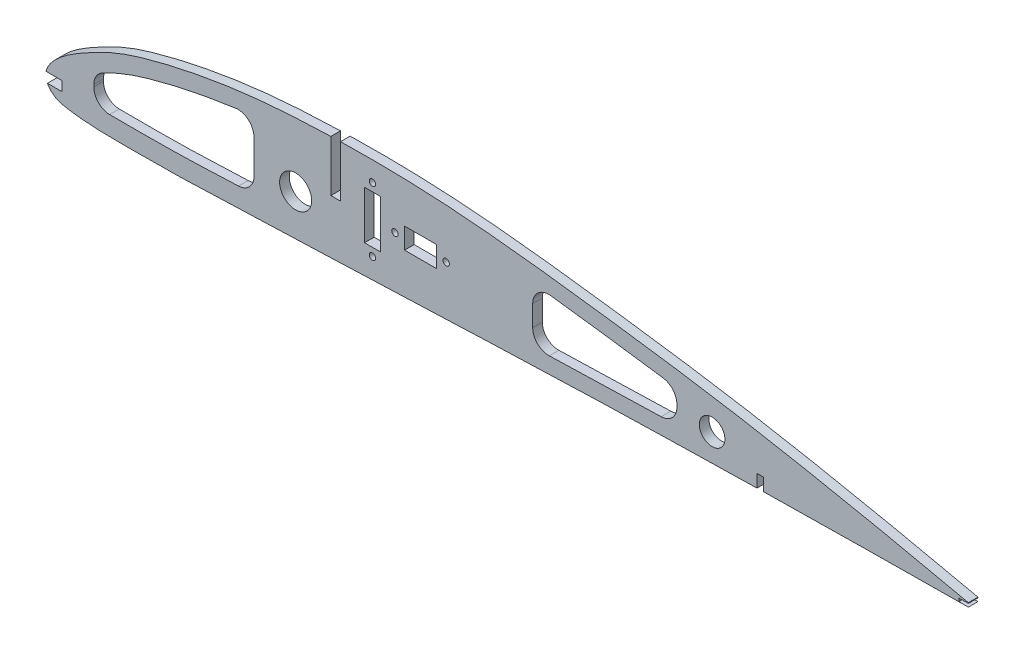
from build123d import *

# Parameters (mm, degrees)
SKETCH_1_R          = 5
SKETCH_1_R_2        = 4
EXTRUDE_1_DEPTH     = 3
SKETCH_3_R          = 1
SKETCH_3_W          = 10
SKETCH_3_H          = 6.5
SKETCH_3_W_2        = 5
SKETCH_3_H_2        = 15
CUT_EXTRUDE_2_DEPTH = 291.422386836


with BuildPart() as part:
    # 草图1 → 凸台-拉伸1 (new body)
    with BuildSketch(Plane.XY):
        with BuildLine():
            Line((90, 12.3715), (90, 28.372426217))
            add(Edge.make_bspline(
                [(90, 28.372426217), (89.259446982, 28.350928743), (82.363996343, 28.13322439), (72.403347361, 27.586524792), (60.185862052, 26.226268085), (51.080991088, 24.79810862), (42.033943524, 23.000087944), (34.581994337, 21.174922903), (28.697351661, 19.44563851), (24.361981086, 17.983441115), (20.174828998, 16.207949367), (16.078941989, 14.139912989), (12.040296713, 11.946766626), (8.14011433, 9.56039573), (5.153679337, 7.316395724), (3.100060439, 5.200618052), (1.813825976, 3.470730924), (1.237398467, 2.180506339), (1.085380705, 1.529058937), (1.078882286, 1.5)],
                knots=[0.345773533, 0.345773533, 0.345773533, 0.345773533, 0.349398211, 0.379527288, 0.394591827, 0.409656366, 0.424720905, 0.439785444, 0.447317713, 0.454849983, 0.462382252, 0.469914522, 0.477446791, 0.484979061, 0.49251133, 0.496277465, 0.5000436, 0.503809734, 0.503985678, 0.503985678, 0.503985678, 0.503985678], degree=3))
            Line((1.078882286, 1.5), (6, 1.5))
            Line((6, 1.5), (6, -1.5))
            Line((6, -1.5), (1.522379628, -1.5))
            add(Edge.make_bspline(
                [(1.522379628, -1.5), (1.617903461, -1.678770523), (2.068186491, -2.42442122), (3.143139608, -3.601090845), (4.854253, -4.619355756), (6.927567017, -5.105597911), (9.209034621, -5.454839075), (12.219971865, -5.84289763), (16.020132359, -6.14266222), (20.609524976, -6.2611368), (25.231457517, -6.286948592), (31.397380169, -6.280305851), (39.107274969, -6.240736398), (48.336813051, -6.022096429), (57.579935967, -5.612990736), (66.840654471, -5.242934226), (76.096556555, -4.921715721), (88.435998513, -4.515955408), (103.853120896, -3.973102953), (122.354625015, -3.248110744), (140.857835973, -2.495489966), (159.368527813, -1.804089638), (177.884173919, -1.222493213), (196.4033921, -0.774877257), (211.439290174, -0.454334834), (220.305576898, -0.265987383), (223, -0.210849605)],
                knots=[0.510182255, 0.510182255, 0.510182255, 0.510182255, 0.511342004, 0.515108139, 0.518874273, 0.522640408, 0.526406543, 0.530172677, 0.537704947, 0.545237216, 0.552769486, 0.560301755, 0.575366294, 0.590430833, 0.605495372, 0.620559911, 0.63562445, 0.650688989, 0.680818067, 0.710947144, 0.741076222, 0.7712053, 0.801334378, 0.831463456, 0.861592533, 0.874744372, 0.874744372, 0.874744372, 0.874744372], degree=3))
            Line((223, -0.210849605), (223, 3.788737263))
            Line((223, 3.788737263), (225, 3.788737263))
            Line((225, 3.788737263), (225, -0.170338801))
            add(Edge.make_bspline(
                [(225, -0.170338801), (227.811595191, -0.114017747), (236.796798206, 0.056910764), (251.961175933, 0.256656825), (270.471854229, 0.429163033), (282.824771355, 0.587434741), (289, 0.610062865)],
                knots=[0.877998396, 0.877998396, 0.877998396, 0.877998396, 0.891721611, 0.921850689, 0.951979767, 0.982108845, 0.982108845, 0.982108845, 0.982108845], degree=3))
            Line((289, 0.610062865), (286, 0.610062865))
            Line((286, 0.610062865), (286, 1.610062865))
            Line((286, 1.610062865), (289, 1.610062865))
            Line((289, 1.610062865), (289, 1.816246039))
            add(Edge.make_bspline(
                [(289, 1.816246039), (276.957314444, 4.502285023), (258.861554155, 8.397620333), (234.648247971, 13.152786595), (216.448478593, 16.478914183), (198.182873559, 19.371550405), (179.850571346, 21.924148488), (161.503162682, 24.358614825), (143.127892269, 26.473190985), (124.712239059, 28.043780086), (107.994173705, 28.616385423), (97.416270032, 28.546670082), (93, 28.44913561)],
                knots=[0.017978355, 0.017978355, 0.017978355, 0.017978355, 0.07823651, 0.108365588, 0.138494666, 0.168623744, 0.198752821, 0.228881899, 0.259010977, 0.289140055, 0.319269133, 0.340879606, 0.340879606, 0.340879606, 0.340879606], degree=3))
            Line((93, 28.44913561), (93, 12.3715))
            Line((93, 12.3715), (90, 12.3715))
        make_face()
        with Locations((79, 8)):
            Circle(SKETCH_1_R, mode=Mode.SUBTRACT)
        with Locations((209, 8)):
            Circle(SKETCH_1_R_2, mode=Mode.SUBTRACT)
    extrude(amount=EXTRUDE_1_DEPTH)

    # 草图3 → 切除-拉伸2 (cut, through all)
    with BuildSketch(Plane.XY):
        with Locations(Location((110, 12.3715, 0), (0, 0, 180))):
            Circle(SKETCH_3_R)
        with Locations(Location((126, 12.3715, 0), (0, 0, 180))):
            Circle(SKETCH_3_R)
        with Locations(Location((103, 22.3715, 0), (0, 0, 180))):
            Circle(SKETCH_3_R)
        with Locations(Location((103, 2.3715, 0), (0, 0, 180))):
            Circle(SKETCH_3_R)
        with BuildLine():
            Line((16, 5.402967421), (16, 4.74959002))
            ThreePointArc((16, 4.74959002), (17.438137187, 1.240582567), (20.925253321, -0.249851242))
            add(Edge.make_bspline(
                [(20.925253321, -0.249851242), (22.914045789, -0.279585692), (24.903284625, -0.283778057), (29.14616948, -0.28369414), (31.399982567, -0.278002295), (38.161511328, -0.238823637), (42.669255398, -0.168803371), (51.680216376, 0.117967683), (56.183014764, 0.33147635), (60.85831542, 0.520784363), (61.02954636, 0.527691534), (61.200778311, 0.534573017)],
                knots=[0.014317915, 0.014317915, 0.014317915, 0.014317915, 0.020284927, 0.020284927, 0.027046569, 0.027046569, 0.040569854, 0.040569854, 0.054093138, 0.054093138, 0.054607249, 0.054607249, 0.054607249, 0.054607249], degree=3))
            ThreePointArc((61.200778311, 0.534573017), (64.605821096, 2.066719442), (66, 5.530540197))
            Line((66, 5.530540197), (66, 16.175207171))
            ThreePointArc((66, 16.175207171), (64.287676463, 19.942325894), (60.32352661, 21.129234195))
            add(Edge.make_bspline(
                [(60.32352661, 21.129234195), (59.143282742, 20.968071656), (57.964431768, 20.796736398), (53.109249428, 20.046773379), (49.445857595, 19.384253181), (42.158673028, 17.868714577), (38.533379611, 17.019586343), (33.148990447, 15.546220745), (31.362942012, 15.022439399), (27.821005995, 13.880218625), (26.067238608, 13.253271835), (22.635818059, 11.812670552), (20.957942753, 11.004847704), (19.099592195, 10.049689097), (18.896441621, 9.944700093), (18.693547477, 9.839213217)],
                knots=[0.029920383, 0.029920383, 0.029920383, 0.029920383, 0.033494004, 0.033494004, 0.044658672, 0.044658672, 0.05582334, 0.05582334, 0.061405674, 0.061405674, 0.066988008, 0.066988008, 0.072570342, 0.072570342, 0.073256353, 0.073256353, 0.073256353, 0.073256353], degree=3))
            ThreePointArc((18.693547477, 9.839213217), (16.726110517, 7.997937304), (16, 5.402967421))
        make_face()
        with Locations((118, 12.3715)):
            Rectangle(SKETCH_3_W, SKETCH_3_H)
        with Locations((103, 12.3715)):
            Rectangle(SKETCH_3_W_2, SKETCH_3_H_2)
        with BuildLine():
            Line((153, 14.659796962), (153, 8.136010376))
            ThreePointArc((153, 8.136010376), (154.52636013, 4.539647484), (158.17353042, 3.139022564))
            add(Edge.make_bspline(
                [(158.17353042, 3.139022564), (161.058246521, 3.239200114), (163.943505856, 3.335590583), (171.504636491, 3.576232826), (176.18199895, 3.713351663), (184.945921303, 3.946800138), (189.03214497, 4.046860263), (193.116453453, 4.14201244)],
                knots=[0.711426146, 0.711426146, 0.711426146, 0.711426146, 0.75, 0.75, 0.8125, 0.8125, 0.867133534, 0.867133534, 0.867133534, 0.867133534], degree=3))
            ThreePointArc((193.116453453, 4.14201244), (196.576469437, 5.64653729), (198, 9.140656115))
            Line((198, 9.140656115), (198, 9.967295711))
            ThreePointArc((198, 9.967295711), (196.781019979, 13.238975389), (193.718444833, 14.915410202))
            add(Edge.make_bspline(
                [(193.718444833, 14.915410202), (192.779013077, 15.051811632), (191.839123333, 15.187073825), (186.824226186, 15.902901834), (182.740892869, 16.465870736), (174.565909682, 17.575800313), (170.481299177, 18.120965891), (163.799588722, 18.980812945), (161.201113289, 19.307400191), (158.603501679, 19.623241907)],
                knots=[0.485575284, 0.485575284, 0.485575284, 0.485575284, 0.5, 0.5, 0.5625, 0.5625, 0.625, 0.625, 0.664795718, 0.664795718, 0.664795718, 0.664795718], degree=3))
            ThreePointArc((158.603501679, 19.623241907), (154.684695217, 18.402623995), (153, 14.659796962))
        make_face()
    extrude(amount=CUT_EXTRUDE_2_DEPTH, mode=Mode.SUBTRACT)


solid = part.part
